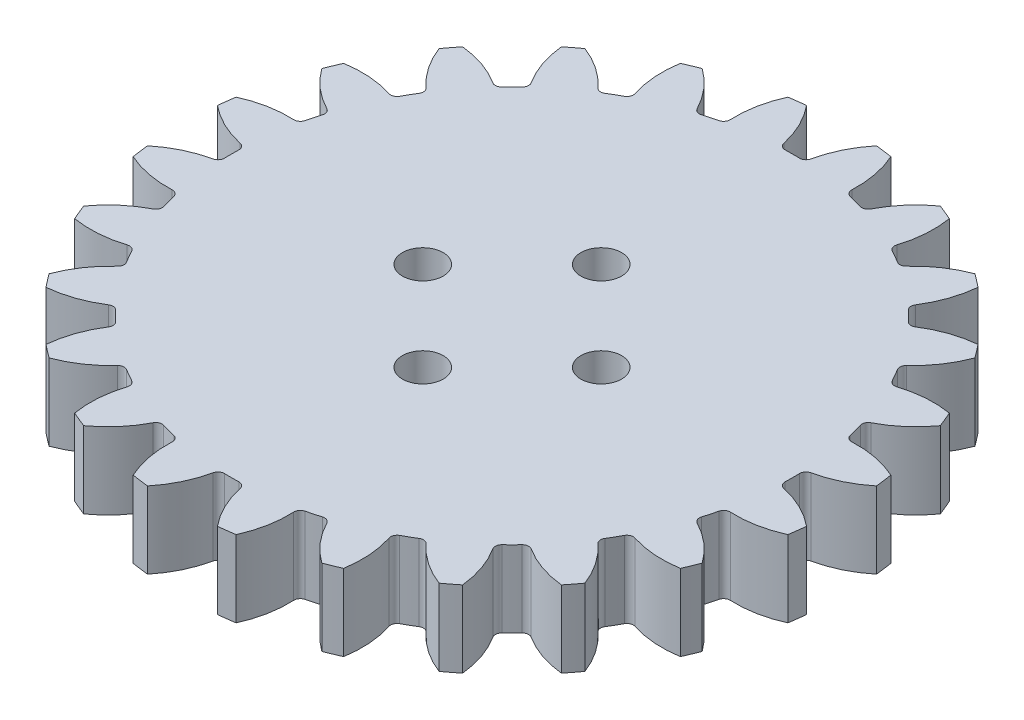
from build123d import *

# Parameters (mm, degrees)
SKETCH_1_R               = 26
EXTRUDE_1_DEPTH          = 6
CUT_EXTRUDE_1_DEPTH      = 38.25587202
PATTERN_CIRCULAR_1_COUNT = 24
SKETCH_3_R               = 1.6
CUT_EXTRUDE_2_DEPTH      = 38.053541255


with BuildPart() as part:
    # 草图1 → 凸台-拉伸1 (new body)
    with BuildSketch(Plane(origin=(0, 0, 0), x_dir=(1, 0, 0), z_dir=(0, 1, 0))):
        with Locations(Location((0, 0, 0), (0, 0, 270))):
            Circle(SKETCH_1_R)
    extrude(amount=EXTRUDE_1_DEPTH)

    # 草图2 → 切除-拉伸1 (cut, through all)
    with BuildSketch(Plane(origin=(0, 0, 0), x_dir=(1, 0, 0), z_dir=(0, 1, 0))):
        with BuildLine():
            ThreePointArc((0.560547841, 21.992857616), (0, 22), (-0.560547841, 21.992857616))
            ThreePointArc((-0.560547841, 21.992857616), (-0.882061796, 22.099428872), (-1.06187474, 22.386475838))
            ThreePointArc((-1.06187474, 22.386475838), (-1.695394394, 24.220742425), (-2.741813312, 25.855027746))
            ThreePointArc((-2.741813312, 25.855027746), (0, 26), (2.741813312, 25.855027746))
            ThreePointArc((2.741813312, 25.855027746), (1.695394394, 24.220742425), (1.06187474, 22.386475838))
            ThreePointArc((1.06187474, 22.386475838), (0.882061796, 22.099428872), (0.560547841, 21.992857616))
        make_face()
    cut_extrude_1 = extrude(amount=CUT_EXTRUDE_1_DEPTH, mode=Mode.SUBTRACT)

    # 阵列(圆周)1: 切除-拉伸1 ×24 about axis
    pattern_circular_1_axis = Axis((0, 0, 0), (0, 1, 0))
    for i in range(1, PATTERN_CIRCULAR_1_COUNT):
        add(cut_extrude_1.rotate(pattern_circular_1_axis, i * 360 / PATTERN_CIRCULAR_1_COUNT), mode=Mode.SUBTRACT)

    # 草图3 → 切除-拉伸2 (cut, through all)
    with BuildSketch(Plane(origin=(0, 0, 0), x_dir=(1, 0, 0), z_dir=(0, 1, 0))):
        with Locations(Location((0, 7, 0), (0, 0, 270))):
            Circle(SKETCH_3_R)
        with Locations(Location((7, 0, 0), (0, 0, 270))):
            Circle(SKETCH_3_R)
        with Locations(Location((0, -7, 0), (0, 0, 270))):
            Circle(SKETCH_3_R)
        with Locations(Location((-7, 0, 0), (0, 0, 270))):
            Circle(SKETCH_3_R)
    extrude(amount=CUT_EXTRUDE_2_DEPTH, mode=Mode.SUBTRACT)


solid = part.part
